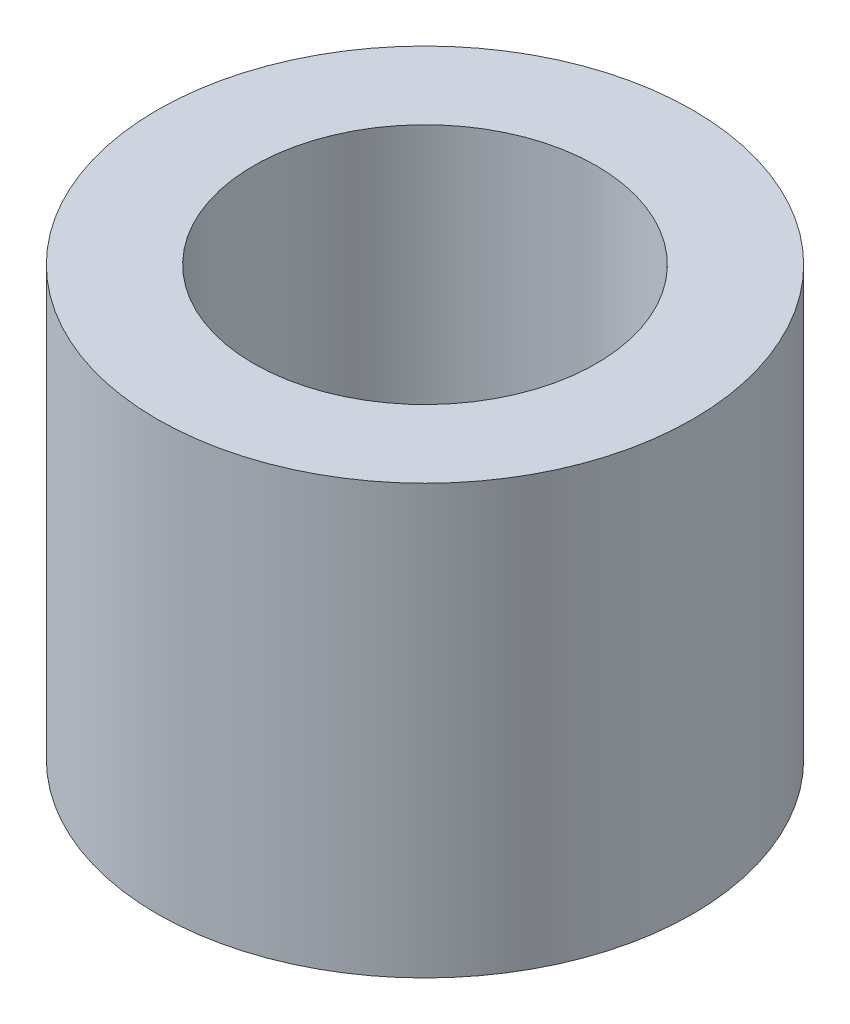
from build123d import *

# Parameters (mm, degrees)
SKETCH_1_R      = 2.5
SKETCH_1_R_2    = 1.6
EXTRUDE_1_DEPTH = 4


with BuildPart() as part:
    # 草图1 → 凸台-拉伸1 (new body)
    with BuildSketch(Plane(origin=(0, 0, 0), x_dir=(1, 0, 0), z_dir=(0, 1, 0))):
        with Locations(Location((0, 0, 0), (0, 0, 270))):
            Circle(SKETCH_1_R)
        with Locations(Location((0, 0, 0), (0, 0, 270))):
            Circle(SKETCH_1_R_2, mode=Mode.SUBTRACT)
    extrude(amount=EXTRUDE_1_DEPTH)


solid = part.part
